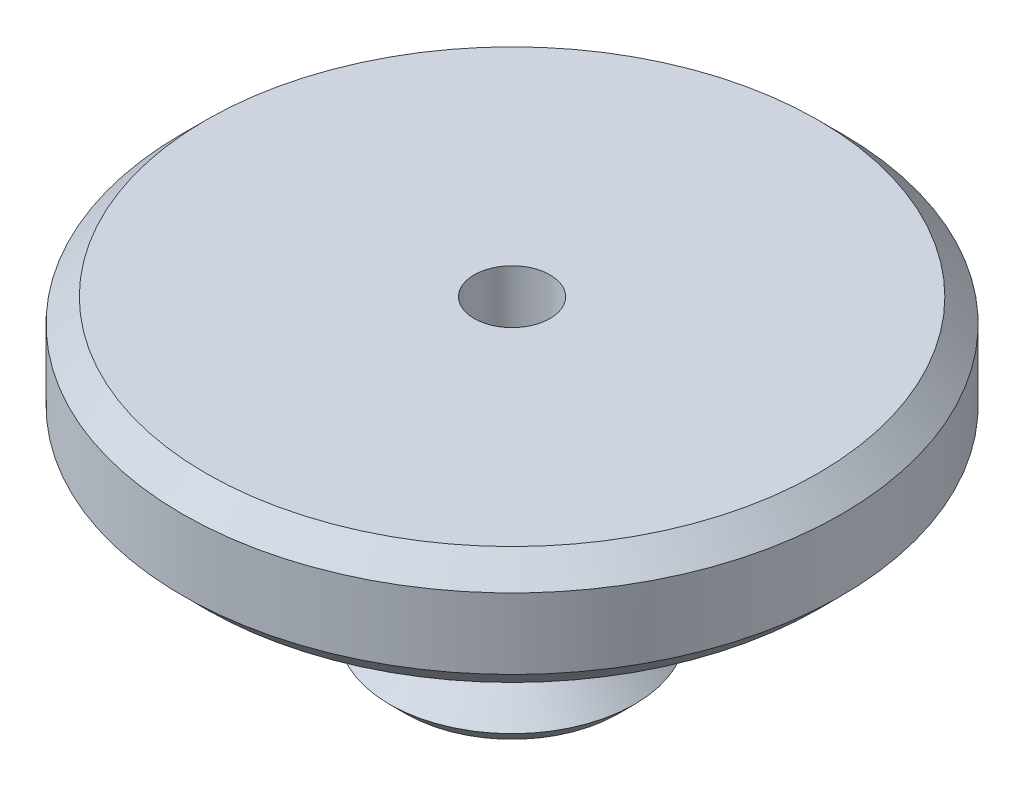
from build123d import *

# Parameters (mm, degrees)
SKETCH_2_R          = 1.61
CUT_EXTRUDE_1_DEPTH = 24.744394037
CHAMFER_1_SIZE      = 0.39
CHAMFER_2_SIZE      = 1


with BuildPart() as part:
    # Эскиз1 → Повернуть1 (revolve)
    with BuildSketch(Plane.XY, mode=Mode.PRIVATE) as revolve_1_sk:
        Polygon((0, 0), (14, 0), (14, -5), (5, -5), (5, -10), (4, -10), (4, -11.2), (5.2, -12.4), (4.492893219, -13.107106781), (2.585786438, -11.2), (2.585786438, -10), (0, -10), align=None)
    revolve(revolve_1_sk.sketch.rotate(Axis((0, -10, 0), (0, 1, 0)), 90), axis=Axis((0, -10, 0), (0, 1, 0)))

    # Эскиз2 → Вырез-Вытянуть1 (cut, through all)
    with BuildSketch(Plane(origin=(0, 0, 0), x_dir=(1, 0, 0), z_dir=(0, 1, 0))):
        with Locations(Location((0, 0, 0), (0, 0, 270))):
            Circle(SKETCH_2_R)
    extrude(amount=-CUT_EXTRUDE_1_DEPTH, mode=Mode.SUBTRACT)

    # Фаска1
    chamfer_1_edges = [part.edges().sort_by_distance(p)[0] for p in [
        (0, -10, -1.61),
    ]]
    chamfer(chamfer_1_edges, length=CHAMFER_1_SIZE)

    # Фаска2
    chamfer_2_edges = [part.edges().sort_by_distance(p)[0] for p in [
        (0, -5, 14),
        (0, 0, 14),
    ]]
    chamfer(chamfer_2_edges, length=CHAMFER_2_SIZE)


solid = part.part
